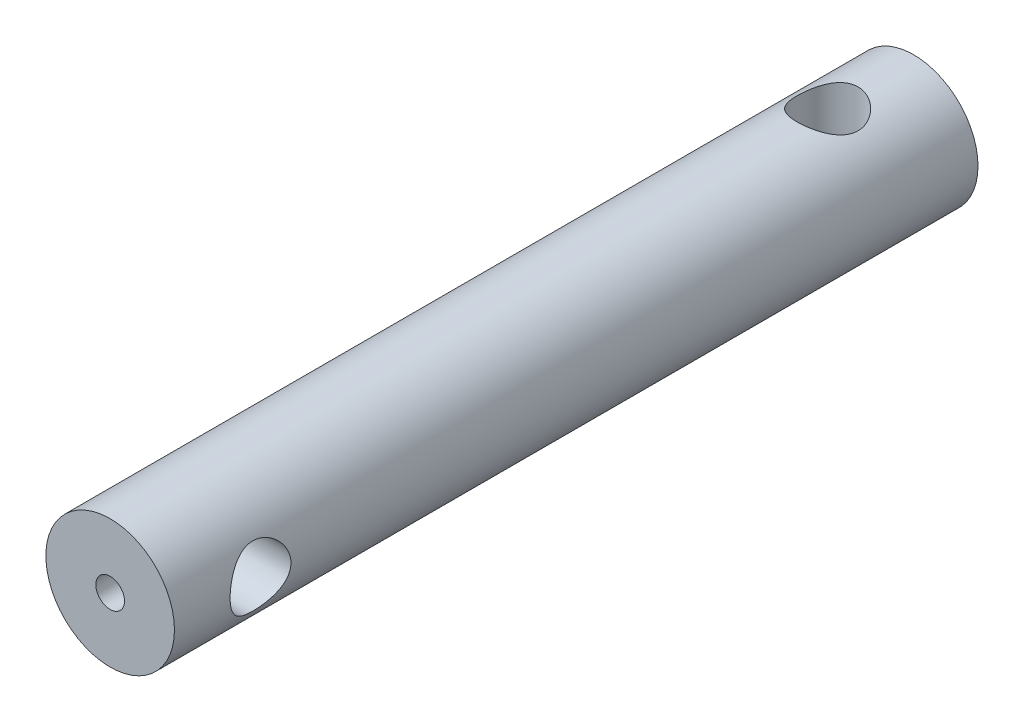
from build123d import *

# Parameters (mm, degrees)
SKETCH1_R               = 7.112
SKETCH1_R_2             = 1.5875
BOSS_EXTRUDE1_DEPTH     = 88.9
CUT_EXTRUDE2_DEPTH      = 90.467150888
CUT_EXTRUDE2_DEPTH_BACK = 90.467150888
SKETCH7_R               = 3.3655
CUT_EXTRUDE3_DEPTH      = 90.467151003
CUT_EXTRUDE3_DEPTH_BACK = 90.467151003
SKETCH8_R               = 3.3655


with BuildPart() as part:
    # Sketch1 → Boss-Extrude1 (new body)
    with BuildSketch(Plane.XY):
        Circle(SKETCH1_R)
        Circle(SKETCH1_R_2, mode=Mode.SUBTRACT)
    extrude(amount=BOSS_EXTRUDE1_DEPTH)

    # Sketch7 → Cut-Extrude2 (cut, two sides: drawn at the far end of the back side and taken through both)
    with BuildSketch(Plane(origin=(0, 0, 0), x_dir=(1, 0, 0), z_dir=(0, 1, 0)).offset(-CUT_EXTRUDE2_DEPTH_BACK)):
        with Locations(Location((0, -9.525, 0), (0, 0, 270))):
            Circle(SKETCH7_R)
    extrude(amount=CUT_EXTRUDE2_DEPTH + CUT_EXTRUDE2_DEPTH_BACK, mode=Mode.SUBTRACT)

    # Sketch8 → Cut-Extrude3 (cut, two sides: drawn at the far end of the back side and taken through both)
    with BuildSketch(Plane(origin=(0, 0, 0), x_dir=(0, 0, -1), z_dir=(1, 0, 0)).offset(-CUT_EXTRUDE3_DEPTH_BACK)):
        with Locations((-79.375, 0)):
            Circle(SKETCH8_R)
    extrude(amount=CUT_EXTRUDE3_DEPTH + CUT_EXTRUDE3_DEPTH_BACK, mode=Mode.SUBTRACT)


solid = part.part
